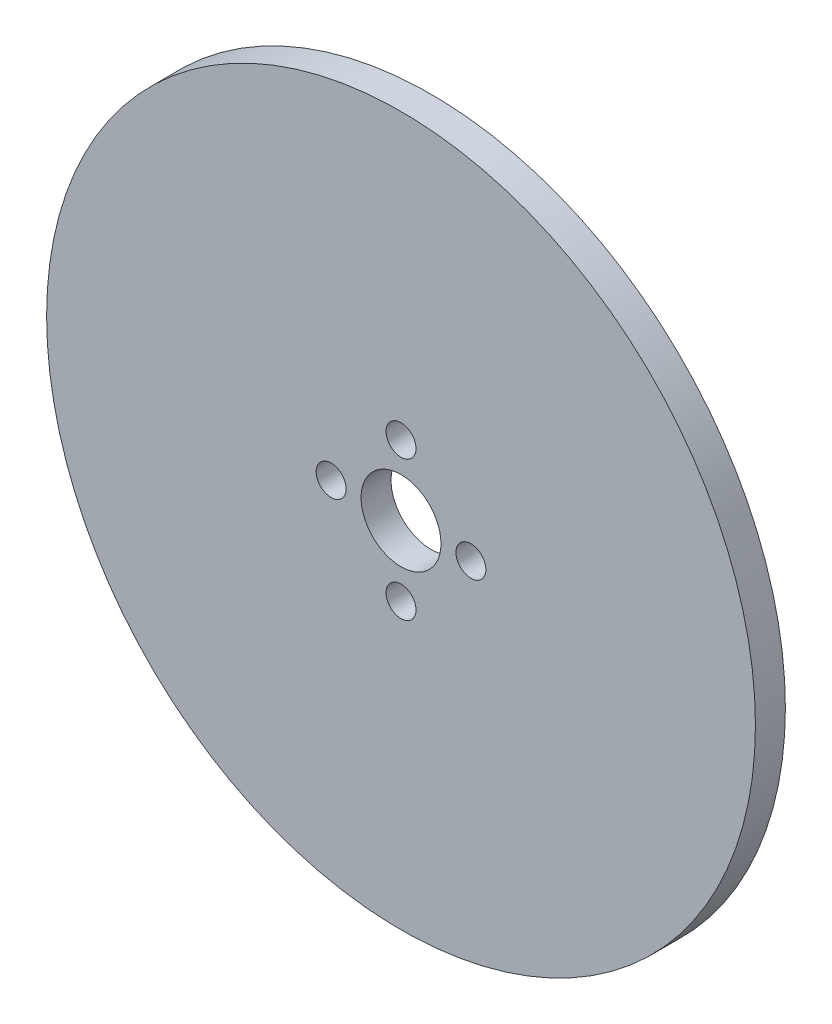
from build123d import *

# Parameters (mm, degrees)
SKETCH_1_R      = 35.5
SKETCH_1_R_2    = 4
SKETCH_1_R_3    = 1.5
EXTRUDE_2_DEPTH = 3


with BuildPart() as part:
    # 草图1 → 凸台-拉伸2 (new body)
    with BuildSketch(Plane.XY):
        Circle(SKETCH_1_R)
        Circle(SKETCH_1_R_2, mode=Mode.SUBTRACT)
        with Locations((7, 0)):
            Circle(SKETCH_1_R_3, mode=Mode.SUBTRACT)
        with Locations((0, -7)):
            Circle(SKETCH_1_R_3, mode=Mode.SUBTRACT)
        with Locations((-7, 0)):
            Circle(SKETCH_1_R_3, mode=Mode.SUBTRACT)
        with Locations((0, 7)):
            Circle(SKETCH_1_R_3, mode=Mode.SUBTRACT)
    extrude(amount=EXTRUDE_2_DEPTH)


solid = part.part
